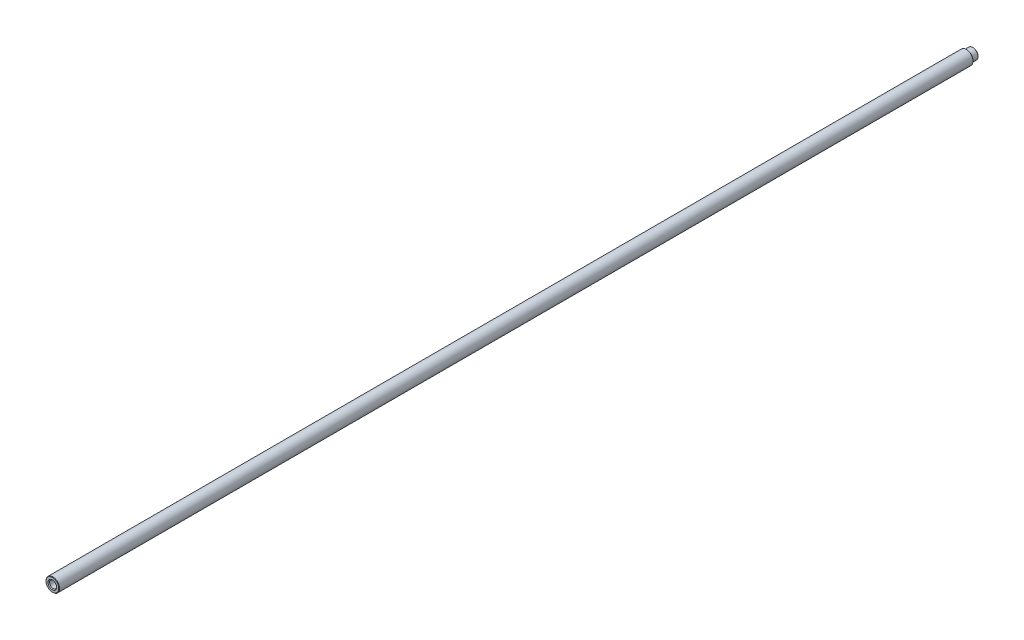
from build123d import *

# Parameters (mm, degrees)
SKETCH1_R                       = 3.175
BOSS_EXTRUDE1_DEPTH             = 215
M4X0_7_TAPPED_HOLE1_D           = 3.3
M4X0_7_TAPPED_HOLE1_DEPTH       = 13.5
M4X0_7_TAPPED_HOLE1_CSINK_D     = 4
M4X0_7_TAPPED_HOLE1_CSINK_ANGLE = 90
M4X0_7_TAPPED_HOLE1_TIP         = 0.991420021
M4X0_7_TAPPED_HOLE2_D           = 3.3
M4X0_7_TAPPED_HOLE2_DEPTH       = 13.5
M4X0_7_TAPPED_HOLE2_CSINK_D     = 4
M4X0_7_TAPPED_HOLE2_CSINK_ANGLE = 90
M4X0_7_TAPPED_HOLE2_TIP         = 0.991420021
SKETCH7_W                       = 0.675
SKETCH7_H                       = 3
CHAMFER1_SIZE                   = 0.2


with BuildPart() as part:
    # Sketch1 → Boss-Extrude1 (new, symmetric)
    with BuildSketch(Plane.XY):
        Circle(SKETCH1_R)
    extrude(amount=BOSS_EXTRUDE1_DEPTH, both=True)

    # M4x0.7 Tapped Hole1
    with Locations(Plane(origin=(0, 0, -215), x_dir=(-1, 0, 0), z_dir=(0, 0, -1))):
        with Locations((0, 0)):
            CounterSinkHole(M4X0_7_TAPPED_HOLE1_D / 2, M4X0_7_TAPPED_HOLE1_CSINK_D / 2, depth=M4X0_7_TAPPED_HOLE1_DEPTH, counter_sink_angle=M4X0_7_TAPPED_HOLE1_CSINK_ANGLE)
            with Locations((0, 0, -(M4X0_7_TAPPED_HOLE1_DEPTH + M4X0_7_TAPPED_HOLE1_TIP / 2))):  # 118° drill point
                Cone(0, M4X0_7_TAPPED_HOLE1_D / 2, M4X0_7_TAPPED_HOLE1_TIP, mode=Mode.SUBTRACT)

    # M4x0.7 Tapped Hole2
    with Locations(Plane.XY.offset(215)):
        with Locations((0, 0)):
            CounterSinkHole(M4X0_7_TAPPED_HOLE2_D / 2, M4X0_7_TAPPED_HOLE2_CSINK_D / 2, depth=M4X0_7_TAPPED_HOLE2_DEPTH, counter_sink_angle=M4X0_7_TAPPED_HOLE2_CSINK_ANGLE)
            with Locations((0, 0, -(M4X0_7_TAPPED_HOLE2_DEPTH + M4X0_7_TAPPED_HOLE2_TIP / 2))):  # 118° drill point
                Cone(0, M4X0_7_TAPPED_HOLE2_D / 2, M4X0_7_TAPPED_HOLE2_TIP, mode=Mode.SUBTRACT)

    # Sketch7 → Cut-Revolve1 (revolve, cut)
    with BuildSketch(Plane(origin=(0, 0, 0), x_dir=(1, 0, 0), z_dir=(0, 1, 0)), mode=Mode.PRIVATE) as cut_revolve1_sk:
        with Locations((2.8375, 213.5)):
            Rectangle(SKETCH7_W, SKETCH7_H)
    revolve(cut_revolve1_sk.sketch.rotate(Axis((0, 0, -232.2463), (0, 0, 1)), 180), axis=Axis((0, 0, -232.2463), (0, 0, 1)), mode=Mode.SUBTRACT)

    # Chamfer1
    chamfer1_edges = [part.edges().sort_by_distance(p)[0] for p in [
        (2.5, 0, -215),
        (-3.175, 0, -212),
        (-3.175, 0, 215),
    ]]
    chamfer(chamfer1_edges, length=CHAMFER1_SIZE)


solid = part.part
